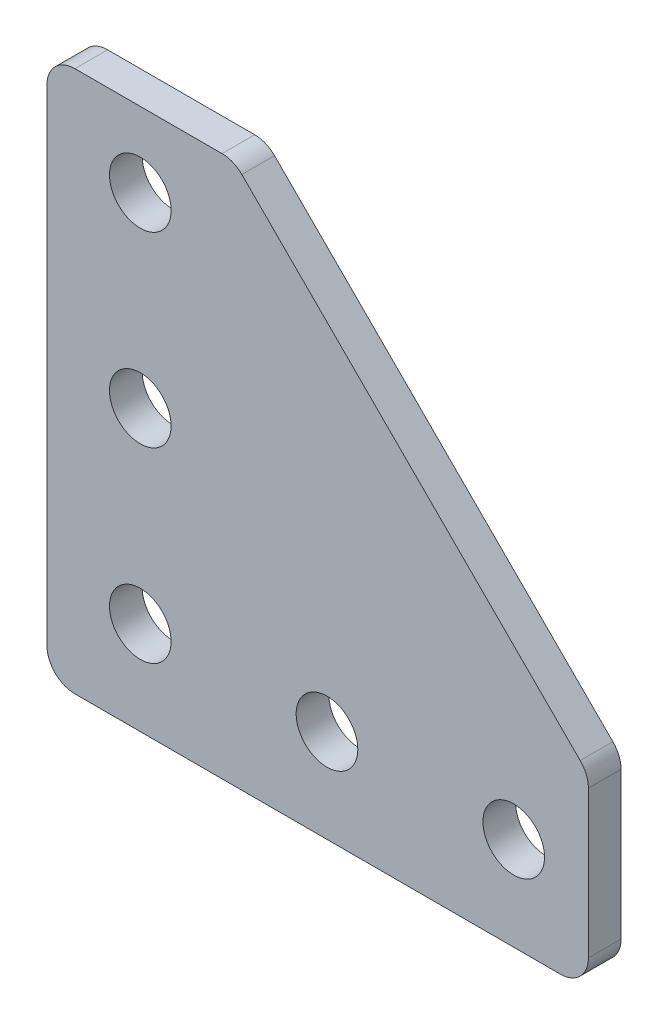
from build123d import *

# Parameters (mm, degrees)
RESSALTO_EXTRUS_O1_DEPTH = 1.75
ESBO_O2_R                = 3.3
CORTE_EXTRUS_O1_DEPTH    = 42.161268202
FILETE1_R                = 3


with BuildPart() as part:
    # Esboço1 → Ressalto-extrusão1 (new, symmetric)
    with BuildSketch(Plane.XY):
        Polygon((29, -9), (-9, 29), (-29, 29), (-29, -29), (29, -29), align=None)
    extrude(amount=RESSALTO_EXTRUS_O1_DEPTH, both=True)

    # Esboço2 → Corte-extrusão1 (cut, through all)
    with BuildSketch(Plane.XY.offset(1.75)):
        with Locations((-19, -19)):
            Circle(ESBO_O2_R)
        with Locations((1, -19)):
            Circle(ESBO_O2_R)
        with Locations((21, -19)):
            Circle(ESBO_O2_R)
        with Locations((-19, 1)):
            Circle(ESBO_O2_R)
        with Locations((-19, 21)):
            Circle(ESBO_O2_R)
    extrude(amount=-CORTE_EXTRUS_O1_DEPTH, mode=Mode.SUBTRACT)

    # Filete1
    filete1_edges = [part.edges().sort_by_distance(p)[0] for p in [
        (29, -29, 0),
        (-29, -29, 0),
        (-29, 29, 0),
        (-9, 29, 0),
        (29, -9, 0),
    ]]
    fillet(filete1_edges, radius=FILETE1_R)


solid = part.part
